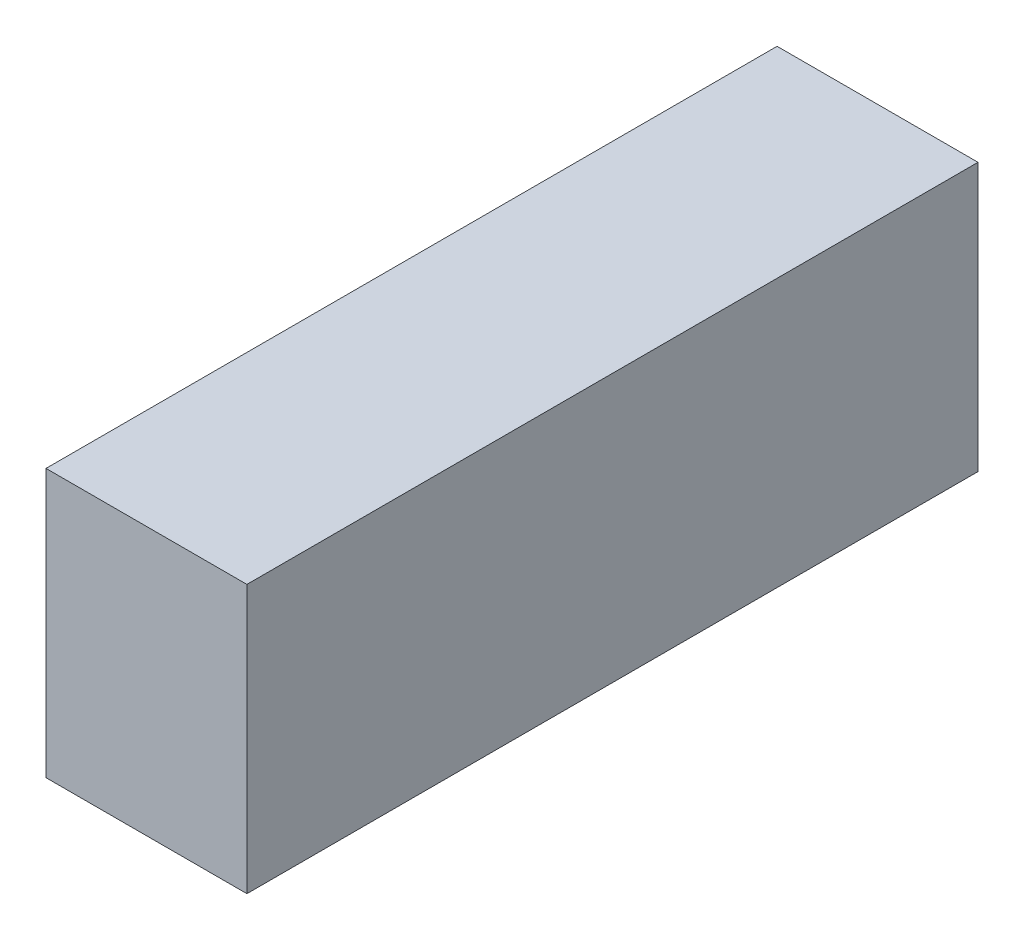
from build123d import *

# Parameters (mm, degrees)
SKETCH4_W           = 114.3
SKETCH4_H           = 152.4
BOSS_EXTRUDE1_DEPTH = 415.925


with BuildPart() as part:
    # Sketch4 → Boss-Extrude1 (new body)
    with BuildSketch(Plane.XY):
        with Locations((118.720101482, 36.855203443)):
            Rectangle(SKETCH4_W, SKETCH4_H)
    extrude(amount=BOSS_EXTRUDE1_DEPTH)


solid = part.part
